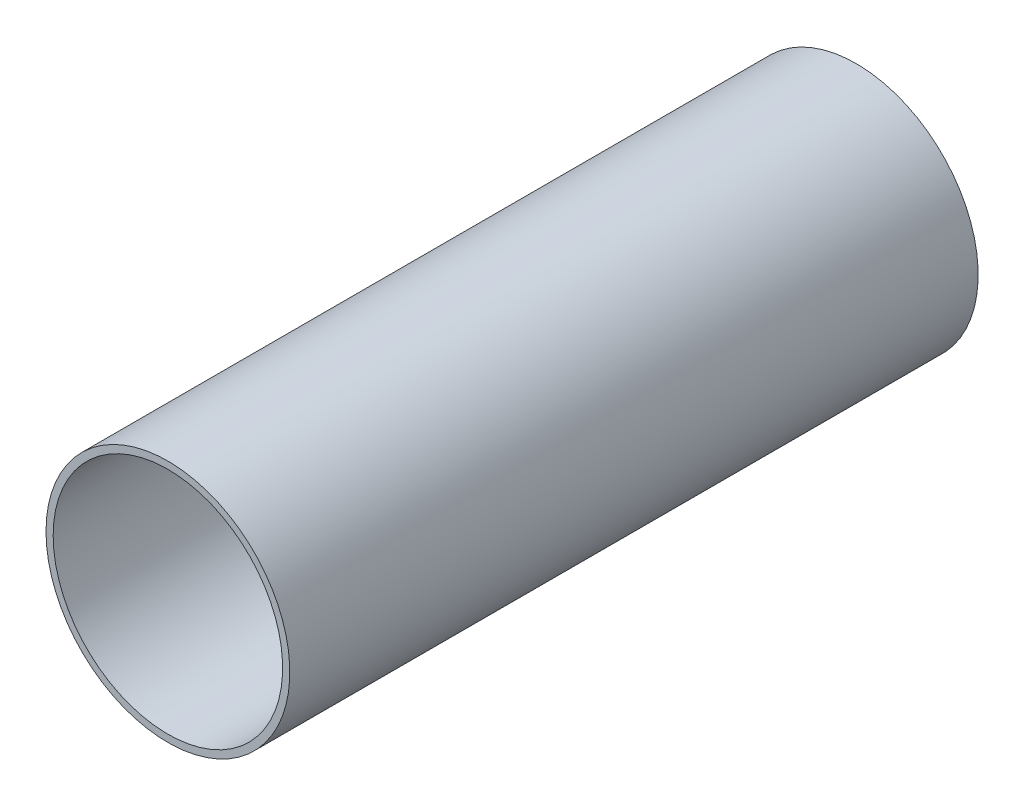
from build123d import *

# Parameters (mm, degrees)
SKETCH2_R           = 107.95
SKETCH2_R_2         = 101.6
BOSS_EXTRUDE1_DEPTH = 609.6


with BuildPart() as part:
    # Sketch2 → Boss-Extrude1 (new body)
    with BuildSketch(Plane.XY):
        with Locations(Location((0, 0, 0), (0, 0, 180))):
            Circle(SKETCH2_R)
        with Locations(Location((0, 0, 0), (0, 0, 180))):
            Circle(SKETCH2_R_2, mode=Mode.SUBTRACT)
    extrude(amount=BOSS_EXTRUDE1_DEPTH)


solid = part.part
